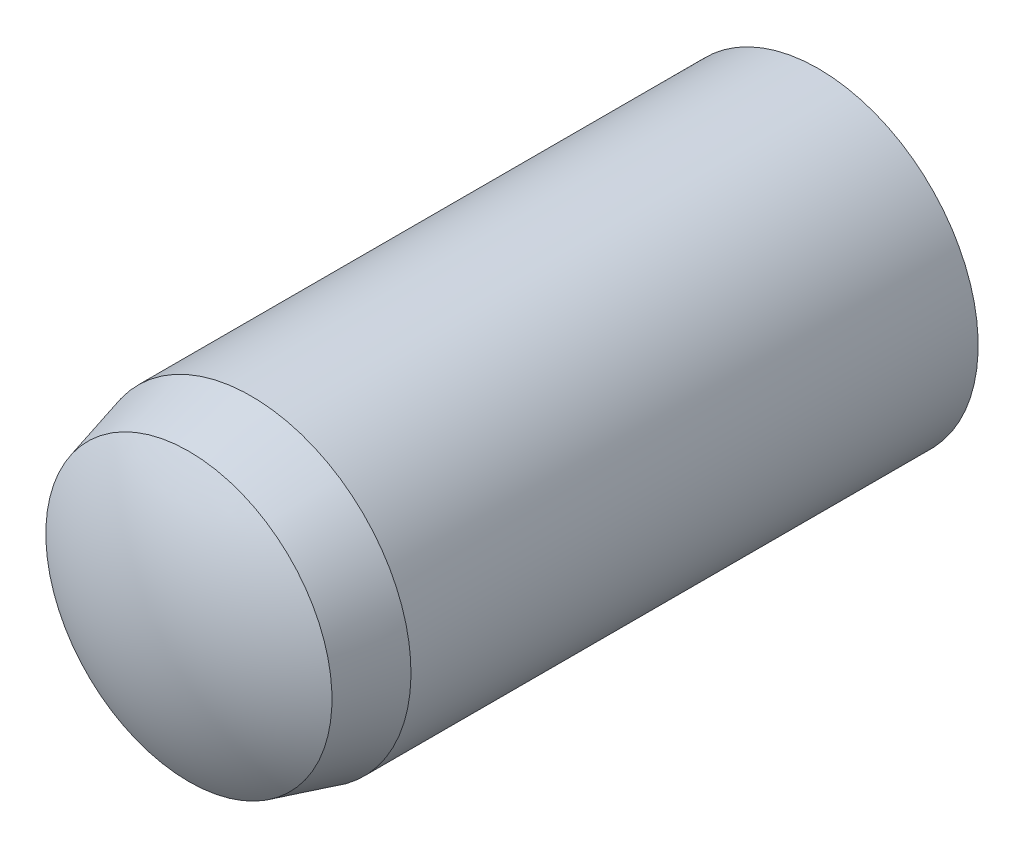
from build123d import *


with BuildPart() as part:
    # Sketch3 → Revolve1 (revolve)
    with BuildSketch(Plane(origin=(0, 0, 0), x_dir=(0, 0, -1), z_dir=(1, 0, 0))):
        with BuildLine():
            Line((-9, 0), (9, 0))
            ThreePointArc((9, 0), (8.693537673, 2.088061302), (7.8, 4))
            Line((7.8, 4), (-6.4, 4))
            Line((-6.4, 4), (-7.96, 3.58199926))
            ThreePointArc((-7.96, 3.58199926), (-8.734740106, 1.864961038), (-9, 0))
        make_face()
    revolve(axis=Axis((0, 0, 9), (0, 0, -1)))


solid = part.part
